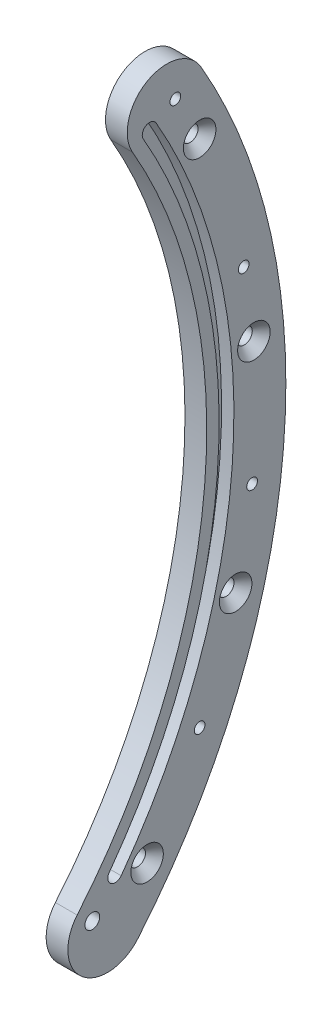
from build123d import *

# Parameters (mm, degrees)
BOSS_EXTRUDE1_DEPTH                                = 3.4925
CUT_EXTRUDE1_DEPTH                                 = 3.96875
CSK_FOR_10_FLAT_HEAD_SOCKET_CAP_SCREW1_D           = 5.1054
CSK_FOR_10_FLAT_HEAD_SOCKET_CAP_SCREW1_CSINK_D     = 10.4394
CSK_FOR_10_FLAT_HEAD_SOCKET_CAP_SCREW1_CSINK_ANGLE = 82
CUT_EXTRUDE2_DEPTH                                 = 245.141012004
CUT_EXTRUDE2_DEPTH_BACK                            = 245.141012004
SKETCH3_3_R                                        = 2.38125
F_8_32_TAPPED_HOLE2_D                              = 3.4544


with BuildPart() as part:
    # Sketch2 → Boss-Extrude1 (new, symmetric)
    with BuildSketch(Plane(origin=(0, 0, 0), x_dir=(0, 0, -1), z_dir=(1, 0, 0))):
        with BuildLine():
            ThreePointArc((153.979316793, 88.9), (177.123417321, -15.496291061), (136.202701987, -114.287637002))
            ThreePointArc((136.202701987, -114.287637002), (137.768063771, -132.179804073), (155.660230842, -130.614442288))
            ThreePointArc((155.660230842, -130.614442288), (202.426762652, -17.710046926), (175.976362049, 101.6))
            ThreePointArc((175.976362049, 101.6), (158.627839421, 106.248522628), (153.979316793, 88.9))
        make_face()
    extrude(amount=BOSS_EXTRUDE1_DEPTH, both=True)

    # Sketch3 → Cut-Extrude1 (cut, symmetric)
    with BuildSketch(Plane.ZY.offset(-3.4925)):
        with BuildLine():
            ThreePointArc((-146.502180766, -107.596419585), (-181.494560711, -9.980125699), (-157.416355114, 90.884375))
            ThreePointArc((-157.416355114, 90.884375), (-158.287953107, 94.137222993), (-161.5408011, 93.265625))
            ThreePointArc((-161.5408011, 93.265625), (-186.249876712, -10.241613709), (-150.340665851, -110.415539748))
            ThreePointArc((-150.340665851, -110.415539748), (-147.011863227, -110.925222209), (-146.502180766, -107.596419585))
        make_face()
    extrude(amount=CUT_EXTRUDE1_DEPTH, both=True, mode=Mode.SUBTRACT)

    # CSK for #10 Flat Head Socket Cap Screw1 (through all)
    with Locations(Plane(origin=(3.4925, 0, 0), x_dir=(0, 0, -1), z_dir=(1, 0, 0))):
        with Locations((175.529160654, 81.850591843), (192.938008153, 16.879888477), (187.075684407, -50.12677856), (158.649272178, -111.08741631)):
            CounterSinkHole(CSK_FOR_10_FLAT_HEAD_SOCKET_CAP_SCREW1_D / 2, CSK_FOR_10_FLAT_HEAD_SOCKET_CAP_SCREW1_CSINK_D / 2, counter_sink_angle=CSK_FOR_10_FLAT_HEAD_SOCKET_CAP_SCREW1_CSINK_ANGLE)

    # Sketch3<3> → Cut-Extrude2 (cut, two sides: drawn at the far end of the back side and taken through both)
    with BuildSketch(Plane.ZY.offset(-3.4925).offset(-CUT_EXTRUDE2_DEPTH_BACK)):
        with Locations((-141.0670842, -118.369338324)):
            Circle(SKETCH3_3_R)
    extrude(amount=CUT_EXTRUDE2_DEPTH + CUT_EXTRUDE2_DEPTH_BACK, mode=Mode.SUBTRACT)

    # #8-32 Tapped Hole2 (through all)
    with Locations(Plane(origin=(3.4925, 0, 0), x_dir=(0, 0, -1), z_dir=(1, 0, 0))):
        with Locations((167.727470078, 96.8375), (189.67379492, 39.164488321), (175.529160654, -81.850591843), (192.365438936, -22.484295143)):
            Hole(F_8_32_TAPPED_HOLE2_D / 2)


solid = part.part
